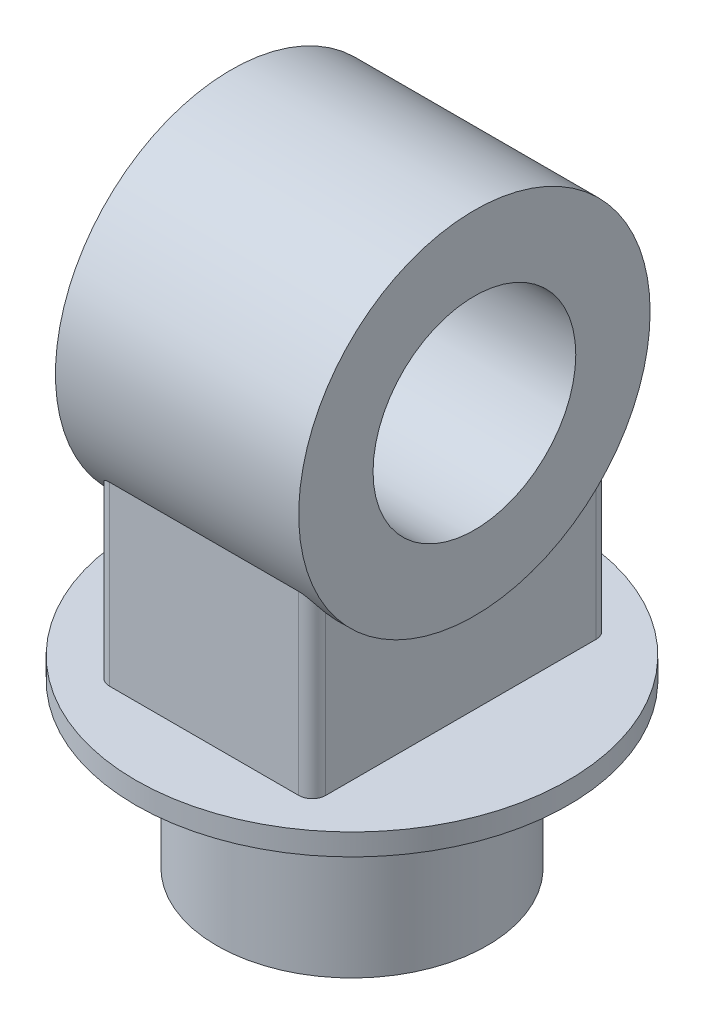
from build123d import *

# Parameters (mm, degrees)
SKETCH1_R           = 100
BOSS_EXTRUDE2_DEPTH = 120
SKETCH3_R           = 160
BOSS_EXTRUDE3_DEPTH = 16
SKETCH4_W           = 220
SKETCH4_H           = 200
BOSS_EXTRUDE4_DEPTH = 80
SKETCH5_R           = 130
BOSS_EXTRUDE5_DEPTH = 90
SKETCH6_R           = 75
CUT_EXTRUDE1_DEPTH  = 90
FILLET1_R           = 10


with BuildPart() as part:
    # Sketch1 → Boss-Extrude2 (new body)
    with BuildSketch(Plane(origin=(0, 0, 0), x_dir=(1, 0, 0), z_dir=(0, 1, 0))):
        with Locations(Location((0, 0, 0), (0, 0, 270))):
            Circle(SKETCH1_R)
    extrude(amount=-BOSS_EXTRUDE2_DEPTH)

    # Sketch3 → Boss-Extrude3 (add)
    with BuildSketch(Plane(origin=(0, 0, 0), x_dir=(1, 0, 0), z_dir=(0, 1, 0))):
        with Locations(Location((0, 0, 0), (0, 0, 270))):
            Circle(SKETCH3_R)
    extrude(amount=BOSS_EXTRUDE3_DEPTH)

    # Sketch4 → Boss-Extrude4 (add, symmetric)
    with BuildSketch(Plane(origin=(0, 0, 0), x_dir=(0, 0, -1), z_dir=(1, 0, 0))):
        with Locations((0.576839133, 116)):
            Rectangle(SKETCH4_W, SKETCH4_H)
    extrude(amount=BOSS_EXTRUDE4_DEPTH, both=True)

    # Sketch5 → Boss-Extrude5 (add, symmetric)
    with BuildSketch(Plane(origin=(0, 0, 0), x_dir=(0, 0, -1), z_dir=(1, 0, 0))):
        with Locations((0.576839133, 216)):
            Circle(SKETCH5_R)
    extrude(amount=BOSS_EXTRUDE5_DEPTH, both=True)

    # Sketch6 → Cut-Extrude1 (cut, symmetric)
    with BuildSketch(Plane(origin=(0, 0, 0), x_dir=(0, 0, -1), z_dir=(1, 0, 0))):
        with Locations((0.576839133, 216)):
            Circle(SKETCH6_R)
    extrude(amount=CUT_EXTRUDE1_DEPTH, both=True, mode=Mode.SUBTRACT)

    # Fillet1
    fillet1_edges = [part.edges().sort_by_distance(p)[0] for p in [
        (-80, 81.358983849, -110.576839133),
        (80, 81.358983849, -110.576839133),
        (-80, 81.358983849, 109.423160867),
        (80, 81.358983849, 109.423160867),
    ]]
    fillet(fillet1_edges, radius=FILLET1_R)


solid = part.part
